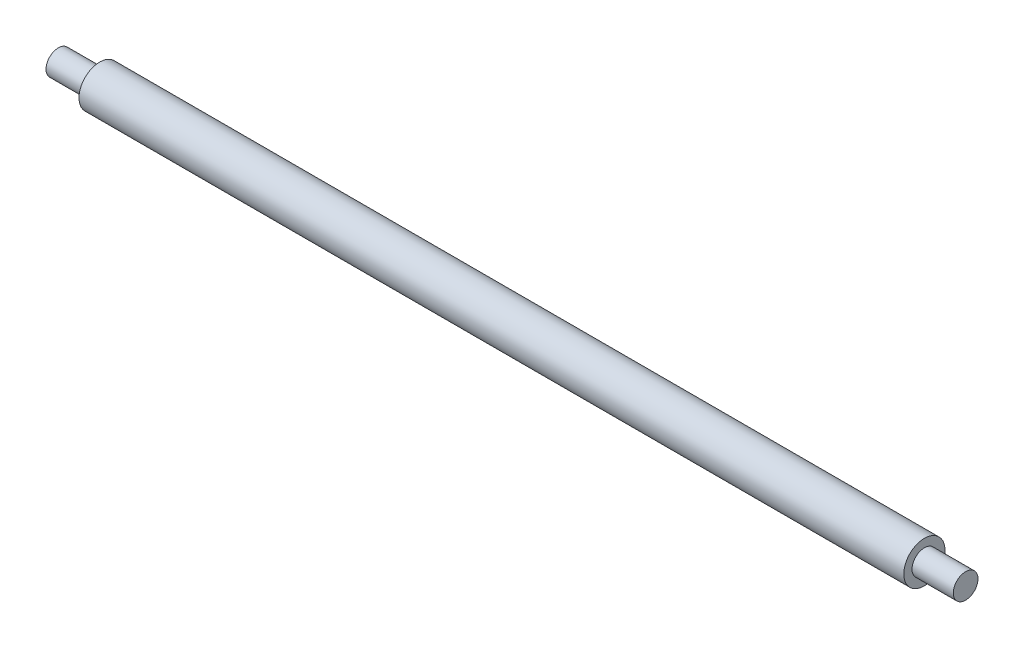
from build123d import *

# Parameters (mm, degrees)
CROQUIS1_R              = 5
SALIENTE_EXTRUIR1_DEPTH = 220
CROQUIS2_R              = 5
SALIENTE_EXTRUIR2_DEPTH = 10
SALIENTE_EXTRUIR3_START = -10
CROQUIS3_R              = 5
SALIENTE_EXTRUIR3_DEPTH = 10
CROQUIS4_OUTSIDE_W      = 56.09
CROQUIS4_OUTSIDE_H      = 56.09
CROQUIS4_OUTSIDE_R      = 3
CORTAR_EXTRUIR1_DEPTH   = 10
CROQUIS5_OUTSIDE_W      = 56.09
CROQUIS5_OUTSIDE_H      = 56.09
CROQUIS5_OUTSIDE_R      = 3
CORTAR_EXTRUIR2_DEPTH   = 10


with BuildPart() as part:
    # Croquis1 → Saliente-Extruir1 (new body)
    with BuildSketch(Plane(origin=(0, 0, 0), x_dir=(0, 0, -1), z_dir=(1, 0, 0))):
        Circle(CROQUIS1_R)
    extrude(amount=SALIENTE_EXTRUIR1_DEPTH)

    # Croquis2 → Saliente-Extruir2 (add)
    with BuildSketch(Plane.ZY):
        with Locations(Location((0, 0, 0), (0, 0, 180))):
            Circle(CROQUIS2_R)
    extrude(amount=-SALIENTE_EXTRUIR2_DEPTH)

    # Croquis3 → Saliente-Extruir3 (add)
    with BuildSketch(Plane(origin=(220, 0, 0), x_dir=(0, 0, -1), z_dir=(1, 0, 0)).offset(SALIENTE_EXTRUIR3_START)):
        Circle(CROQUIS3_R)
    extrude(amount=SALIENTE_EXTRUIR3_DEPTH)

    # Croquis4 outside → Cortar-Extruir1 (cut)
    with BuildSketch(Plane.ZY):
        Rectangle(CROQUIS4_OUTSIDE_W, CROQUIS4_OUTSIDE_H)
        Circle(CROQUIS4_OUTSIDE_R, mode=Mode.SUBTRACT)
    extrude(amount=-CORTAR_EXTRUIR1_DEPTH, mode=Mode.SUBTRACT)

    # Croquis5 outside → Cortar-Extruir2 (cut)
    with BuildSketch(Plane(origin=(220, 0, 0), x_dir=(0, 0, -1), z_dir=(1, 0, 0))):
        Rectangle(CROQUIS5_OUTSIDE_W, CROQUIS5_OUTSIDE_H)
        with Locations(Location((0, 0, 0), (0, 0, 180))):
            Circle(CROQUIS5_OUTSIDE_R, mode=Mode.SUBTRACT)
    extrude(amount=-CORTAR_EXTRUIR2_DEPTH, mode=Mode.SUBTRACT)


solid = part.part
